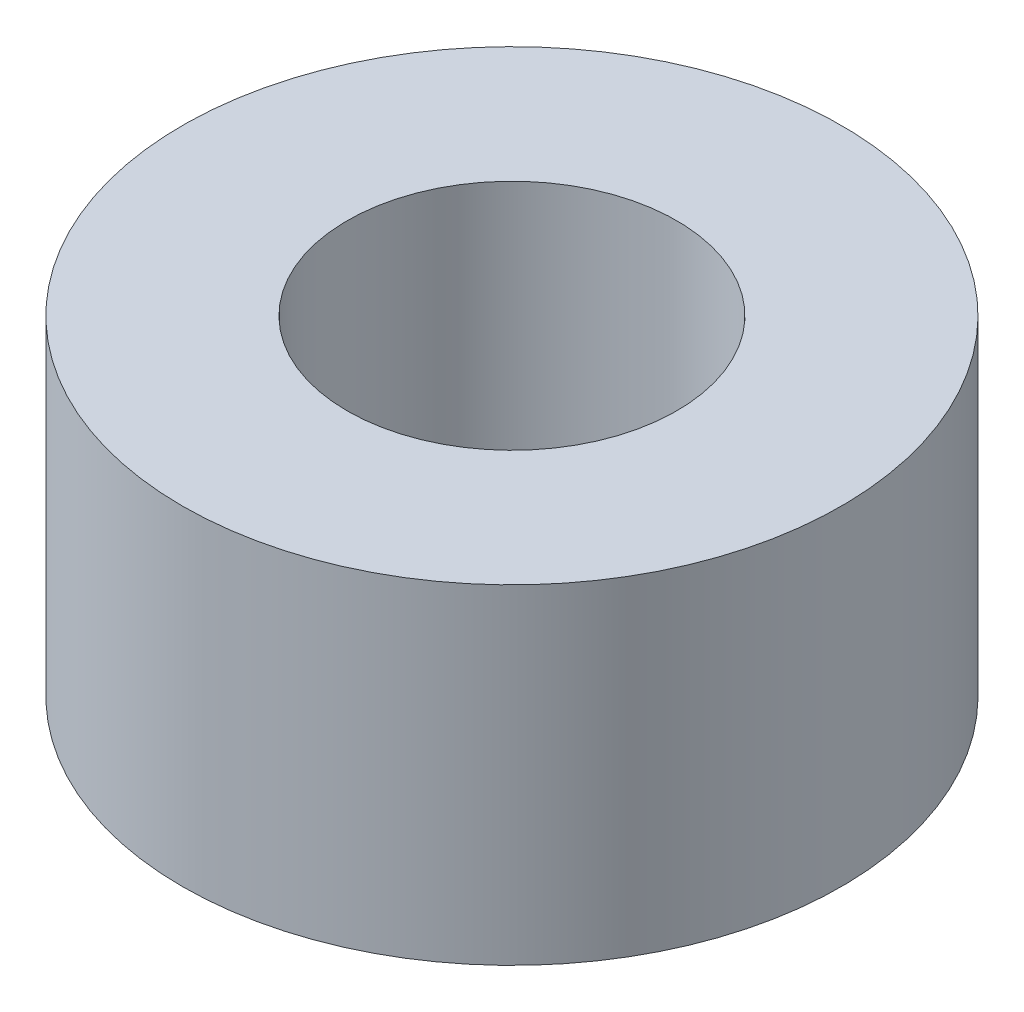
from build123d import *

# Parameters (mm, degrees)
CROQUIS1_R              = 3.175
CROQUIS1_R_2            = 1.5875
SALIENTE_EXTRUIR1_DEPTH = 3.175


with BuildPart() as part:
    # Croquis1 → Saliente-Extruir1 (new body)
    with BuildSketch(Plane(origin=(0, 0, 0), x_dir=(1, 0, 0), z_dir=(0, 1, 0))):
        with Locations(Location((0, 0, 0), (0, 0, 270))):
            Circle(CROQUIS1_R)
        with Locations(Location((0, 0, 0), (0, 0, 270))):
            Circle(CROQUIS1_R_2, mode=Mode.SUBTRACT)
    extrude(amount=SALIENTE_EXTRUIR1_DEPTH)


solid = part.part
